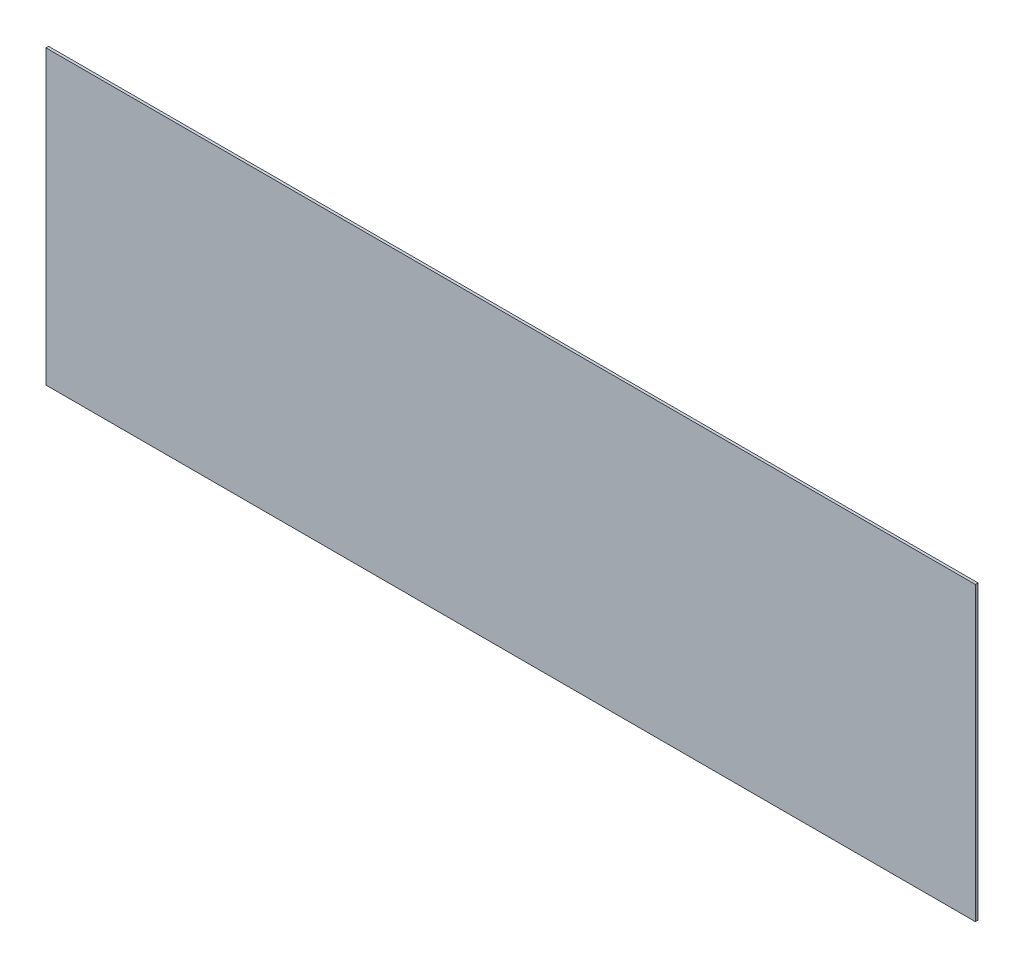
from build123d import *

# Parameters (mm, degrees)
ESQUISSE1_W      = 70
ESQUISSE1_H      = 22
EXTRUSION1_DEPTH = 0.2


with BuildPart() as part:
    # Esquisse1 → Extrusion1 (new body)
    with BuildSketch(Plane.XY):
        with Locations((0.017269645, 5.976220204)):
            Rectangle(ESQUISSE1_W, ESQUISSE1_H)
    extrude(amount=EXTRUSION1_DEPTH)


solid = part.part
